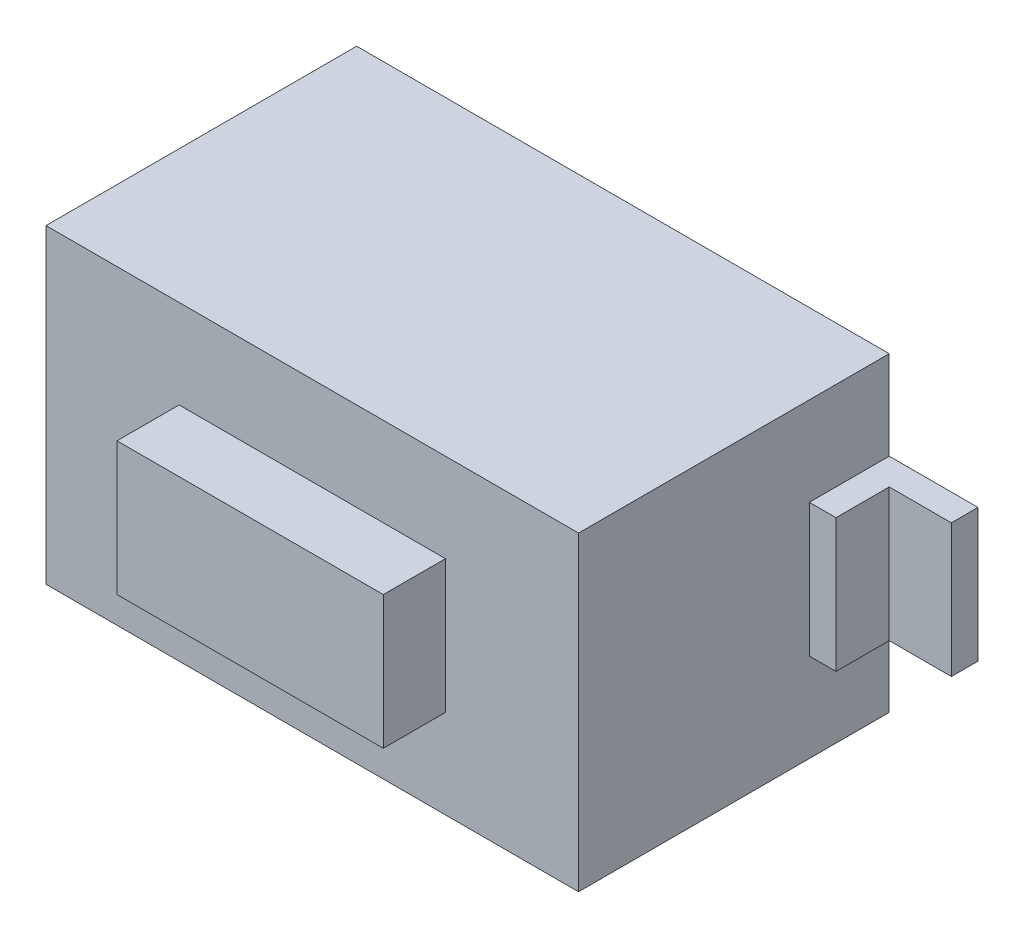
from build123d import *

# Parameters (mm, degrees)
SKETCH1_W           = 6
SKETCH1_H           = 3.5
BOSS_EXTRUDE1_DEPTH = 3.5
SKETCH2_W           = 3
SKETCH2_H           = 1.5
BOSS_EXTRUDE2_DEPTH = 0.7
SKETCH3_W           = 0.3
SKETCH3_H           = 1.5
BOSS_EXTRUDE3_DEPTH = 1
SKETCH4_W           = 0.3
SKETCH4_H           = 1.5
BOSS_EXTRUDE4_DEPTH = 0.6


with BuildPart() as part:
    # Sketch1 → Boss-Extrude1 (new body)
    with BuildSketch(Plane.XY):
        Rectangle(SKETCH1_W, SKETCH1_H)
    extrude(amount=BOSS_EXTRUDE1_DEPTH)

    # Sketch2 → Boss-Extrude2 (add)
    with BuildSketch(Plane.XY.offset(3.5)):
        Rectangle(SKETCH2_W, SKETCH2_H)
    extrude(amount=BOSS_EXTRUDE2_DEPTH)

    # Sketch3 → Boss-Extrude3 (add)
    with BuildSketch(Plane.ZY.offset(3)):
        with Locations((0.15, 0)):
            Rectangle(SKETCH3_W, SKETCH3_H)
    boss_extrude3 = extrude(amount=BOSS_EXTRUDE3_DEPTH)

    # Sketch4 → Boss-Extrude4 (add)
    with BuildSketch(Plane.XY.offset(0.3)):
        with Locations((-3.15, 0)):
            Rectangle(SKETCH4_W, SKETCH4_H)
    boss_extrude4 = extrude(amount=BOSS_EXTRUDE4_DEPTH)

    # Mirror1: Boss-Extrude3, Boss-Extrude4 across plane
    add(boss_extrude3.mirror(Plane(origin=(0, 0, 0), x_dir=(0, 0, 1), z_dir=(1, 0, 0))))
    add(boss_extrude4.mirror(Plane(origin=(0, 0, 0), x_dir=(0, 0, 1), z_dir=(1, 0, 0))))


solid = part.part
